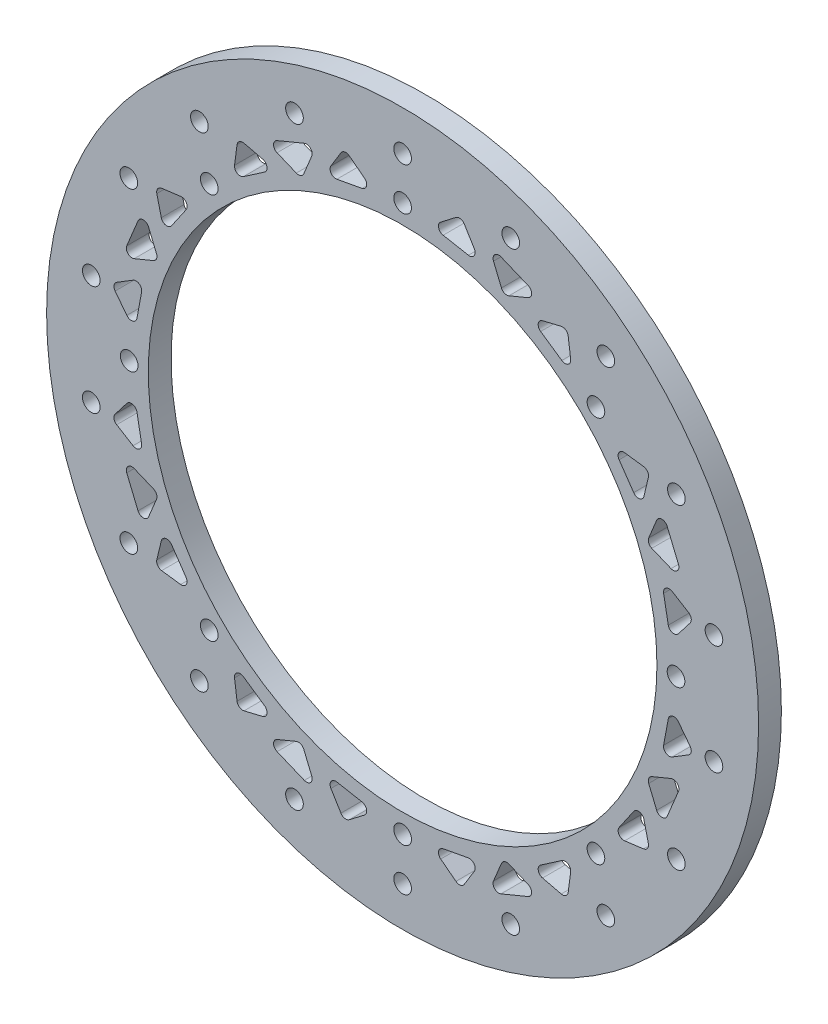
from build123d import *

# Parameters (mm, degrees)
SKETCH_1_R                       = 62.5
SKETCH_1_R_2                     = 44.65
EXTRUDE_1_DEPTH                  = 4
SKETCH_2_R                       = 1.55
CUT_EXTRUDE_1_DEPTH              = 4
PATTERN_CIRCULAR_1_COUNT         = 18
SKETCH_3_R                       = 1.55
CUT_EXTRUDE_2_DEPTH              = 4
PATTERN_CIRCULAR_2_COUNT         = 8
CUT_EXTRUDE_3_DEPTH              = 4
FILLET_1_R                       = 1
PATTERN_CIRCULAR_3_COUNT         = 8
FILLET_1_OF_PATTERN_CIRCULAR_3_R = 1


with BuildPart() as part:
    # 草图1 → 凸台-拉伸1 (new body)
    with BuildSketch(Plane.XY):
        Circle(SKETCH_1_R)
        Circle(SKETCH_1_R_2, mode=Mode.SUBTRACT)
    extrude(amount=EXTRUDE_1_DEPTH)

    # 草图2 → 切除-拉伸1 (cut)
    with BuildSketch(Plane.XY.offset(4)):
        with Locations((0, 55.5)):
            Circle(SKETCH_2_R)
    cut_extrude_1 = extrude(amount=-CUT_EXTRUDE_1_DEPTH, mode=Mode.SUBTRACT)

    # 阵列(圆周)1: 切除-拉伸1 ×18 about axis
    pattern_circular_1_axis = Axis((0, 0, 0), (0, 0, 1))
    for i in range(1, PATTERN_CIRCULAR_1_COUNT):
        add(cut_extrude_1.rotate(pattern_circular_1_axis, i * 360 / PATTERN_CIRCULAR_1_COUNT), mode=Mode.SUBTRACT)

    # 草图3 → 切除-拉伸2 (cut)
    with BuildSketch(Plane.XY.offset(4)):
        with Locations((-48, 0)):
            Circle(SKETCH_3_R)
    cut_extrude_2 = extrude(amount=-CUT_EXTRUDE_2_DEPTH, mode=Mode.SUBTRACT)

    # 阵列(圆周)2: 切除-拉伸2 ×8 about axis
    pattern_circular_2_axis = Axis((0, 0, 0), (0, 0, 1))
    for i in range(1, PATTERN_CIRCULAR_2_COUNT):
        add(cut_extrude_2.rotate(pattern_circular_2_axis, i * 360 / PATTERN_CIRCULAR_2_COUNT), mode=Mode.SUBTRACT)

    # 草图4 → 切除-拉伸3 (cut)
    with BuildSketch(Plane.XY.offset(4)):
        Polygon((-22.380606355, -41.837419446), (-28.921205388, -43.409222323), (-29.797742052, -36.739763314), align=None)
        Polygon((-15.029949112, -49.351136638), (-17.735929613, -42.818321813), (-24.268744438, -45.524302314), align=None)
        Polygon((-13.758044477, -45.409001518), (-10.244575021, -51.145335921), (-4.908750309, -47.049121248), align=None)
    cut_extrude_3 = extrude(amount=-CUT_EXTRUDE_3_DEPTH, mode=Mode.SUBTRACT)

    # 圆角1
    fillet_1_edges = [part.edges().sort_by_distance(p)[0] for p in [
        (-10.244575021, -51.145335921, 2),
        (-13.758044477, -45.409001518, 2),
        (-4.908750309, -47.049121248, 2),
        (-17.735929613, -42.818321813, 2),
        (-15.029949112, -49.351136638, 2),
        (-24.268744438, -45.524302314, 2),
        (-22.380606355, -41.837419446, 2),
        (-28.921205388, -43.409222323, 2),
        (-29.797742052, -36.739763314, 2),
    ]]
    fillet(fillet_1_edges, radius=FILLET_1_R)

    # 阵列(圆周)3: 切除-拉伸3 ×8 about axis
    pattern_circular_3_axis = Axis((0, 0, 0), (0, 0, 1))
    for i in range(1, PATTERN_CIRCULAR_3_COUNT):
        add(cut_extrude_3.rotate(pattern_circular_3_axis, i * 360 / PATTERN_CIRCULAR_3_COUNT), mode=Mode.SUBTRACT)

    # 圆角1 of 阵列(圆周)3
    fillet_1_of_pattern_circular_3_edges = [part.edges().sort_by_distance(p)[0] for p in [
        (28.921205388, -43.409222323, 2),
        (22.380606355, -41.837419446, 2),
        (29.797742052, -36.739763314, 2),
        (17.735929613, -42.818321813, 2),
        (24.268744438, -45.524302314, 2),
        (15.029949112, -49.351136638, 2),
        (13.758044477, -45.409001518, 2),
        (10.244575021, -51.145335921, 2),
        (4.908750309, -47.049121248, 2),
        (51.145335921, -10.244575021, 2),
        (45.409001518, -13.758044477, 2),
        (47.049121248, -4.908750309, 2),
        (42.818321813, -17.735929613, 2),
        (49.351136638, -15.029949112, 2),
        (45.524302314, -24.268744438, 2),
        (41.837419446, -22.380606355, 2),
        (43.409222323, -28.921205388, 2),
        (36.739763314, -29.797742052, 2),
        (43.409222323, 28.921205388, 2),
        (41.837419446, 22.380606355, 2),
        (36.739763314, 29.797742052, 2),
        (42.818321813, 17.735929613, 2),
        (45.524302314, 24.268744438, 2),
        (49.351136638, 15.029949112, 2),
        (45.409001518, 13.758044477, 2),
        (51.145335921, 10.244575021, 2),
        (47.049121248, 4.908750309, 2),
        (10.244575021, 51.145335921, 2),
        (13.758044477, 45.409001518, 2),
        (4.908750309, 47.049121248, 2),
        (17.735929613, 42.818321813, 2),
        (15.029949112, 49.351136638, 2),
        (24.268744438, 45.524302314, 2),
        (22.380606355, 41.837419446, 2),
        (28.921205388, 43.409222323, 2),
        (29.797742052, 36.739763314, 2),
        (-28.921205388, 43.409222323, 2),
        (-22.380606355, 41.837419446, 2),
        (-29.797742052, 36.739763314, 2),
        (-17.735929613, 42.818321813, 2),
        (-24.268744438, 45.524302314, 2),
        (-15.029949112, 49.351136638, 2),
        (-13.758044477, 45.409001518, 2),
        (-10.244575021, 51.145335921, 2),
        (-4.908750309, 47.049121248, 2),
        (-51.145335921, 10.244575021, 2),
        (-45.409001518, 13.758044477, 2),
        (-47.049121248, 4.908750309, 2),
        (-42.818321813, 17.735929613, 2),
        (-49.351136638, 15.029949112, 2),
        (-45.524302314, 24.268744438, 2),
        (-41.837419446, 22.380606355, 2),
        (-43.409222323, 28.921205388, 2),
        (-36.739763314, 29.797742052, 2),
        (-43.409222323, -28.921205388, 2),
        (-41.837419446, -22.380606355, 2),
        (-36.739763314, -29.797742052, 2),
        (-42.818321813, -17.735929613, 2),
        (-45.524302314, -24.268744438, 2),
        (-49.351136638, -15.029949112, 2),
        (-45.409001518, -13.758044477, 2),
        (-51.145335921, -10.244575021, 2),
        (-47.049121248, -4.908750309, 2),
    ]]
    fillet(fillet_1_of_pattern_circular_3_edges, radius=FILLET_1_OF_PATTERN_CIRCULAR_3_R)


solid = part.part
